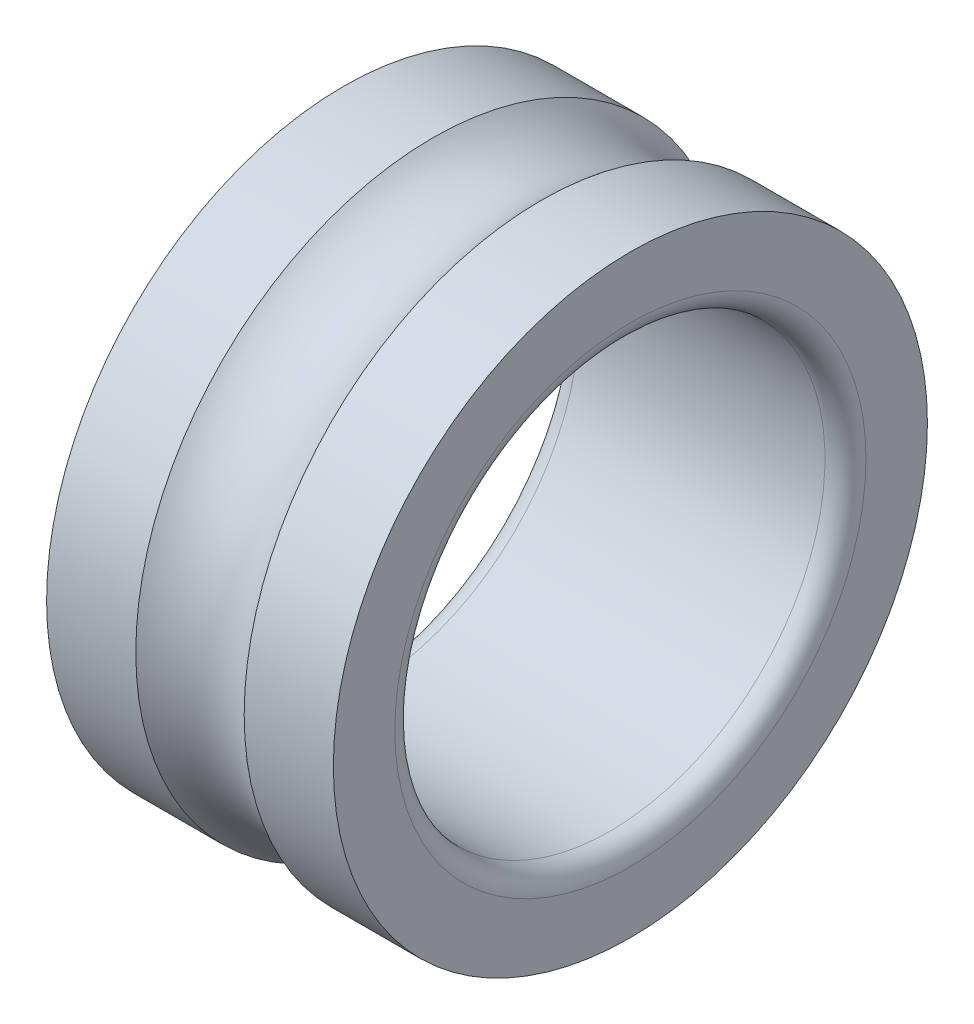
from build123d import *


with BuildPart() as part:
    # Esquisse1 → Base-Révolution (revolve)
    with BuildSketch(Plane.XY):
        with BuildLine():
            Line((-4.285714286, 7.5), (4.285714286, 7.5))
            ThreePointArc((4.285714286, 7.5), (4.790790558, 7.709209442), (5, 8.214285714))
            Line((5, 8.214285714), (5, 10.357142857))
            Line((5, 10.357142857), (1.889822365, 10.357142857))
            ThreePointArc((1.889822365, 10.357142857), (0, 9.642857143), (-1.889822365, 10.357142857))
            Line((-1.889822365, 10.357142857), (-5, 10.357142857))
            Line((-5, 10.357142857), (-5, 8.214285714))
            ThreePointArc((-5, 8.214285714), (-4.790790558, 7.709209442), (-4.285714286, 7.5))
        make_face()
    revolve(axis=Axis((0, 0, 0), (1, 0, 0)))


solid = part.part
